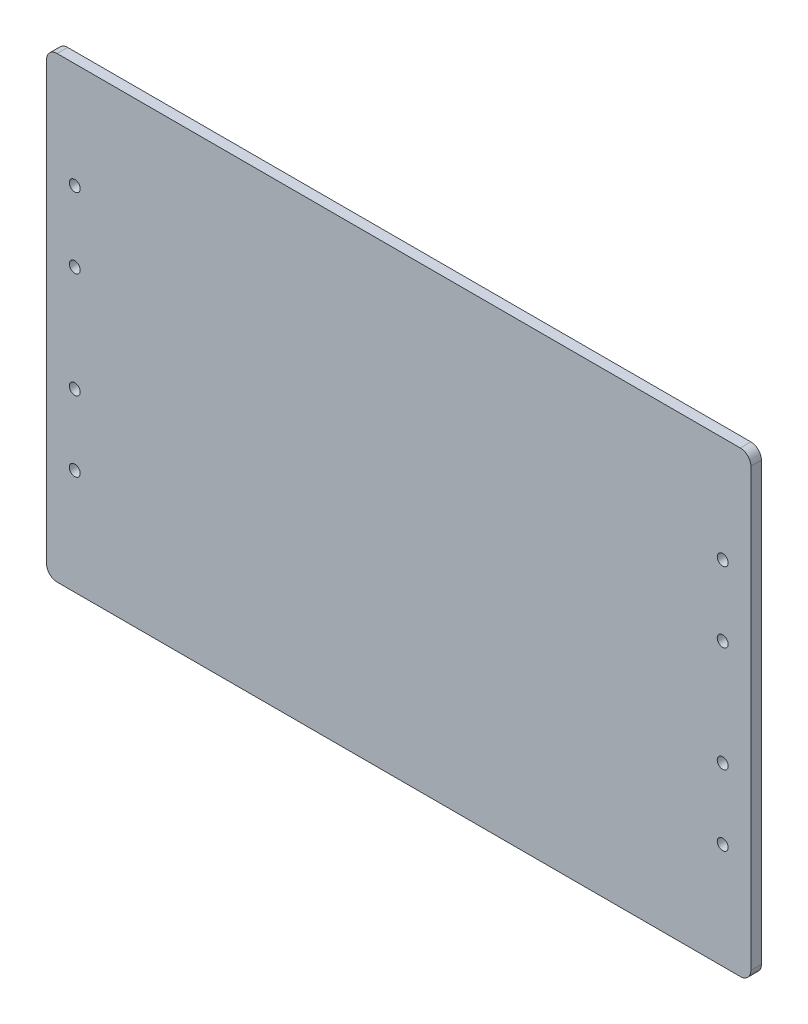
from build123d import *

# Parameters (mm, degrees)
SKETCH_1_W          = 200
SKETCH_1_H          = 130
EXTRUDE_1_DEPTH     = 3
SKETCH_2_R          = 1.55
CUT_EXTRUDE_1_DEPTH = 3
FILLET_2_R          = 3


with BuildPart() as part:
    # 草图1 → 凸台-拉伸1 (new body)
    with BuildSketch(Plane.XY):
        Rectangle(SKETCH_1_W, SKETCH_1_H)
    extrude(amount=EXTRUDE_1_DEPTH)

    # 草图2 → 切除-拉伸1 (cut)
    with BuildSketch(Plane.XY.offset(3)):
        with Locations((-92, 35)):
            Circle(SKETCH_2_R)
        with Locations((-92, 15)):
            Circle(SKETCH_2_R)
        with Locations(Location((-92, -15, 0), (0, 0, 180))):
            Circle(SKETCH_2_R)
        with Locations(Location((-92, -35, 0), (0, 0, 180))):
            Circle(SKETCH_2_R)
    cut_extrude_1 = extrude(amount=-CUT_EXTRUDE_1_DEPTH, mode=Mode.SUBTRACT)

    # 镜向1: 切除-拉伸1 across plane
    add(cut_extrude_1.mirror(Plane(origin=(0, 0, 0), x_dir=(0, 0, 1), z_dir=(1, 0, 0))), mode=Mode.SUBTRACT)

    # 圆角2
    fillet_2_edges = [part.edges().sort_by_distance(p)[0] for p in [
        (100, -65, 1.5),
        (-100, -65, 1.5),
        (-100, 65, 1.5),
        (100, 65, 1.5),
    ]]
    fillet(fillet_2_edges, radius=FILLET_2_R)


solid = part.part
